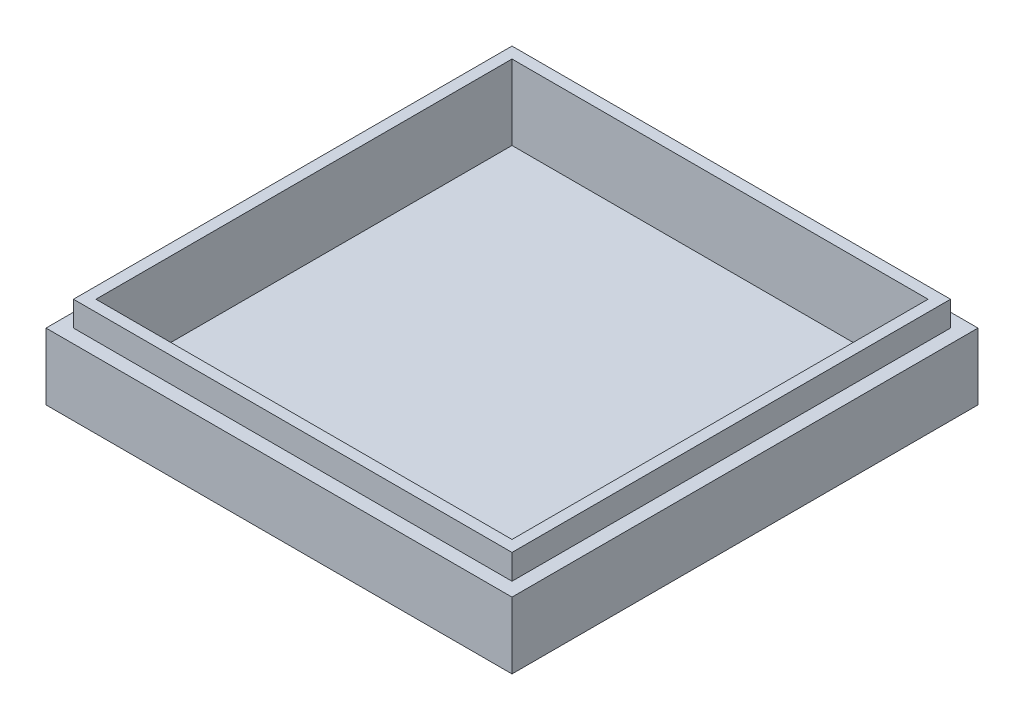
from build123d import *

# Parameters (mm, degrees)
SKETCH1_W           = 56
SKETCH1_H           = 56
BOSS_EXTRUDE1_DEPTH = 2
SKETCH1_3_W         = 56
SKETCH1_3_H         = 56
SKETCH1_3_W_2       = 50
SKETCH1_3_H_2       = 50
BOSS_EXTRUDE2_DEPTH = 6
SKETCH2_W           = 52.7
SKETCH2_H           = 52.7
SKETCH2_W_2         = 50
SKETCH2_H_2         = 50
BOSS_EXTRUDE3_DEPTH = 3


with BuildPart() as part:
    # Sketch1 → Boss-Extrude1 (new body)
    with BuildSketch(Plane(origin=(0, 0, 0), x_dir=(1, 0, 0), z_dir=(0, 1, 0))):
        Rectangle(SKETCH1_W, SKETCH1_H)
    extrude(amount=-BOSS_EXTRUDE1_DEPTH)

    # Sketch1<3> → Boss-Extrude2 (add)
    with BuildSketch(Plane(origin=(0, 0, 0), x_dir=(1, 0, 0), z_dir=(0, 1, 0))):
        Rectangle(SKETCH1_3_W, SKETCH1_3_H)
        Rectangle(SKETCH1_3_W_2, SKETCH1_3_H_2, mode=Mode.SUBTRACT)
    extrude(amount=BOSS_EXTRUDE2_DEPTH)

    # Sketch2 → Boss-Extrude3 (add)
    with BuildSketch(Plane(origin=(0, 6, 0), x_dir=(1, 0, 0), z_dir=(0, 1, 0))):
        Rectangle(SKETCH2_W, SKETCH2_H)
        Rectangle(SKETCH2_W_2, SKETCH2_H_2, mode=Mode.SUBTRACT)
    extrude(amount=BOSS_EXTRUDE3_DEPTH)


solid = part.part
